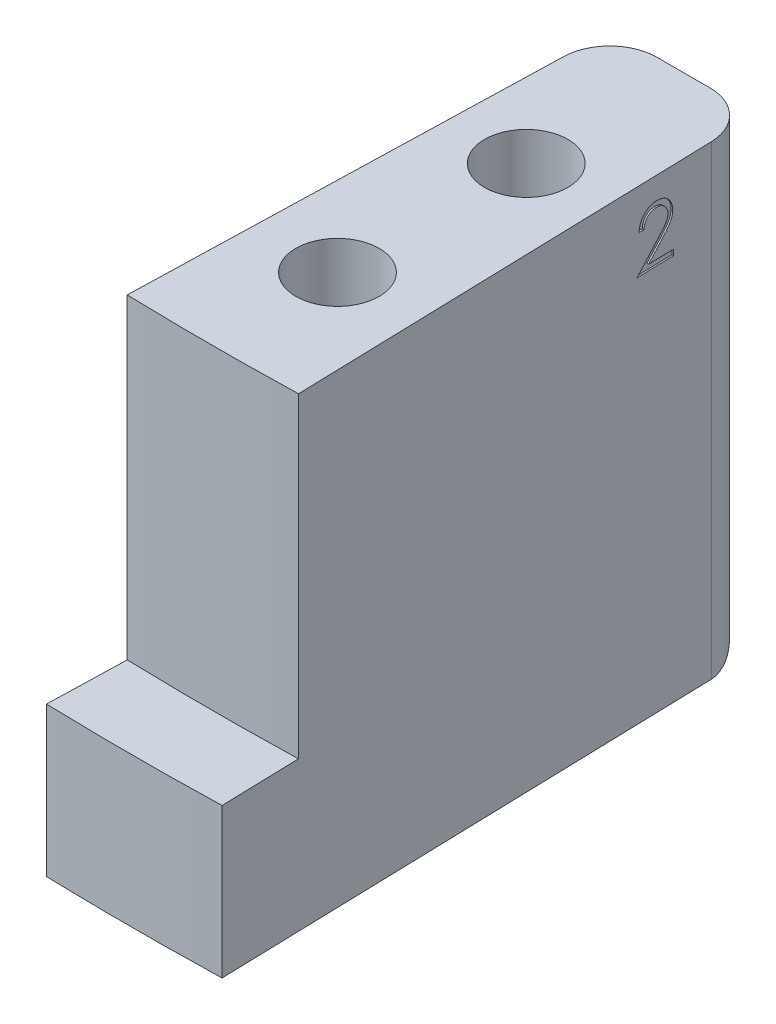
from build123d import *

# Parameters (mm, degrees)
EXTRUDE_590_DEPTH   = 29.6
EXTRUDE_638_DEPTH   = 9.5
FILLET_1_R          = 3
HOLE_WIZARD_M5_1_D  = 5.3
CUT_EXTRUDE_1_DEPTH = 5
CUT_EXTRUDE_2_DEPTH = 0.1


with BuildPart() as part:
    # 草图1 → Extrude 590 (new body)
    with BuildSketch(Plane(origin=(0, 0, 0), x_dir=(1, 0, 0), z_dir=(0, 1, 0))):
        with BuildLine():
            Line((4.608867317, -165), (-4.608867317, -165))
            Line((-4.608867317, -165), (-5.444719551, -194.923972433))
            ThreePointArc((-5.444719551, -194.923972433), (0, -195), (5.444719551, -194.923972433))
            Line((5.444719551, -194.923972433), (4.608867317, -165))
        make_face()
    extrude(amount=EXTRUDE_590_DEPTH)

    # 草图1<3> → Extrude 638 (add)
    with BuildSketch(Plane(origin=(0, 0, 0), x_dir=(1, 0, 0), z_dir=(0, 1, 0))):
        with BuildLine():
            ThreePointArc((5.444719551, -194.923972433), (0, -195), (-5.444719551, -194.923972433))
            Line((-5.444719551, -194.923972433), (-5.584327745, -199.922023008))
            ThreePointArc((-5.584327745, -199.922023008), (0, -200), (5.584327745, -199.922023008))
            Line((5.584327745, -199.922023008), (5.444719551, -194.923972433))
        make_face()
    extrude(amount=EXTRUDE_638_DEPTH)

    # 圆角1
    fillet_1_edges = [part.edges().sort_by_distance(p)[0] for p in [
        (0, 0, 165),
        (-4.608867317, 14.8, 165),
        (4.608867317, 14.8, 165),
    ]]
    fillet(fillet_1_edges, radius=FILLET_1_R)

    # M5 间隙孔1 (through all)
    with Locations(Plane(origin=(0, 29.6, 0), x_dir=(1, 0, 0), z_dir=(0, 1, 0))):
        with Locations((0, -187), (0, -175)):
            Hole(HOLE_WIZARD_M5_1_D / 2)

    # 草图6 → 切除-拉伸1 (cut)
    with BuildSketch(Plane.XZ):
        Polygon((0, 179.792007234), (-4.15, 177.396003617), (-4.15, 172.603996383), (0, 170.207992766), (4.15, 172.603996383), (4.15, 177.396003617), align=None)
        Polygon((0, 191.792007234), (-4.15, 189.396003617), (-4.15, 184.603996383), (0, 182.207992766), (4.15, 184.603996383), (4.15, 189.396003617), align=None)
    extrude(amount=-CUT_EXTRUDE_1_DEPTH, mode=Mode.SUBTRACT)

    # 草图7 → 切除-拉伸2 (cut)
    with BuildSketch(Plane(origin=(0, 0, 0), x_dir=(-0.02792163872356911, 0, -0.9996101150403545), z_dir=(0.9996101150403545, 0, -0.02792163872356911))):
        with BuildLine():
            Line((-172.3983953, 27.023076923), (-172.712497864, 27.023076923))
            add(Edge.make_bspline(
                [(-172.712497864, 27.023076923), (-172.710450711, 27.064747811), (-172.706430157, 27.146588325), (-172.687601868, 27.265912232), (-172.660660991, 27.379967031), (-172.622569537, 27.487836945), (-172.575263259, 27.590475752), (-172.518533231, 27.687475767), (-172.451339381, 27.778466956), (-172.375132647, 27.862605799), (-172.292364008, 27.93979337), (-172.203058068, 28.006448613), (-172.109213041, 28.062766284), (-172.011113642, 28.109847526), (-171.907653079, 28.145187372), (-171.799770221, 28.171409012), (-171.686991084, 28.187185357), (-171.610151062, 28.188881143), (-171.571071582, 28.18974359)],
                knots=[0, 0, 0, 0, 1.10065271, 2.161652631, 3.183658789, 4.190468796, 5.17591951, 6.163126047, 7.15150782, 8.156236427, 9.156009102, 10.134482811, 11.092018607, 12.041330605, 13.001268258, 13.972401359, 14.968799086, 16, 16, 16, 16], degree=3))
            add(Edge.make_bspline(
                [(-171.571071582, 28.18974359), (-171.532693508, 28.188845133), (-171.457281963, 28.187079698), (-171.347219949, 28.171918669), (-171.242442654, 28.148173078), (-171.143154888, 28.114857661), (-171.050148823, 28.070073234), (-170.962725779, 28.016275695), (-170.879844968, 27.954055864), (-170.805238184, 27.88080205), (-170.736730105, 27.802599666), (-170.67762785, 27.719111762), (-170.627014686, 27.632882477), (-170.584827007, 27.543254275), (-170.553770868, 27.449383247), (-170.53019266, 27.352636044), (-170.516865246, 27.252011233), (-170.514819822, 27.183904677), (-170.513779915, 27.149278846)],
                knots=[0, 0, 0, 0, 1.111607364, 2.184268762, 3.212621178, 4.221274766, 5.211760367, 6.196651075, 7.1921475, 8.207485113, 9.220403448, 10.201281604, 11.166441695, 12.114753415, 13.065576456, 14.026450734, 14.996634279, 16, 16, 16, 16], degree=3))
            add(Edge.make_bspline(
                [(-170.513779915, 27.149278846), (-170.515473178, 27.100531012), (-170.51882999, 27.003890798), (-170.547544366, 26.861875935), (-170.592390877, 26.724282516), (-170.646388234, 26.613545214), (-170.700860678, 26.52431172), (-170.749948186, 26.450843015), (-170.807412997, 26.371737547), (-170.874091495, 26.28726021), (-170.948604367, 26.196749304), (-171.03162653, 26.100259509), (-171.123750012, 25.998787739), (-171.188408513, 25.929482138), (-171.221912928, 25.893569712)],
                knots=[0, 0, 0, 0, 1.184426356, 2.348067706, 3.509069118, 4.696110526, 5.333549288, 6.050745305, 6.844228056, 7.710549037, 8.667450064, 9.695053472, 10.805634456, 12, 12, 12, 12], degree=3))
            Line((-171.221912928, 25.893569712), (-172.09761405, 24.958974359))
            Line((-172.09761405, 24.958974359), (-170.46890812, 24.958974359))
            Line((-170.46890812, 24.958974359), (-170.46890812, 24.6))
            Line((-170.46890812, 24.6), (-172.847113249, 24.6))
            Line((-172.847113249, 24.6), (-171.489741454, 26.048517628))
            add(Edge.make_bspline(
                [(-171.489741454, 26.048517628), (-171.456693567, 26.083015935), (-171.39321534, 26.149280121), (-171.303432763, 26.246023081), (-171.222793775, 26.335772622), (-171.150776382, 26.418359171), (-171.088942877, 26.494990738), (-171.034070645, 26.563185442), (-170.990105054, 26.625939892), (-170.942389658, 26.698680506), (-170.896175677, 26.787492823), (-170.856463321, 26.896026513), (-170.832248472, 27.007753765), (-170.829343637, 27.083255802), (-170.827882479, 27.121233974)],
                knots=[0, 0, 0, 0, 1.329631726, 2.553950428, 3.673215718, 4.687767853, 5.603093632, 6.413772471, 7.123043292, 7.734684054, 8.834405432, 9.900288307, 10.943827018, 12, 12, 12, 12], degree=3))
            add(Edge.make_bspline(
                [(-170.827882479, 27.121233974), (-170.828518222, 27.145115373), (-170.829771148, 27.192181023), (-170.840828845, 27.261186782), (-170.857539351, 27.327751596), (-170.881484609, 27.392080215), (-170.913091349, 27.453525867), (-170.951564729, 27.512163347), (-170.995954793, 27.568852313), (-171.047306062, 27.622005611), (-171.103717582, 27.670686816), (-171.163311832, 27.713810902), (-171.226361936, 27.749850012), (-171.292602058, 27.779393509), (-171.361847527, 27.802568891), (-171.434232273, 27.81862747), (-171.509556289, 27.828709954), (-171.560989784, 27.830074126), (-171.587197383, 27.830769231)],
                knots=[0, 0, 0, 0, 0.991446411, 1.95395049, 2.89581595, 3.838931463, 4.798493298, 5.75982156, 6.748411868, 7.785213223, 8.824556874, 9.840280684, 10.836137867, 11.835679398, 12.848801643, 13.863922112, 14.911575587, 16, 16, 16, 16], degree=3))
            add(Edge.make_bspline(
                [(-171.587197383, 27.830769231), (-171.614568216, 27.830054199), (-171.668320012, 27.828649993), (-171.747239045, 27.818827329), (-171.822524823, 27.801881489), (-171.894366726, 27.778704814), (-171.962886312, 27.749246266), (-172.027750356, 27.712554521), (-172.088813245, 27.668771028), (-172.146189768, 27.619130471), (-172.199053747, 27.56386287), (-172.245500623, 27.502252907), (-172.286084637, 27.435425492), (-172.321493871, 27.363560941), (-172.350249561, 27.286007161), (-172.372222711, 27.203039456), (-172.389609558, 27.115018075), (-172.395418079, 27.05423299), (-172.3983953, 27.023076923)],
                knots=[0, 0, 0, 0, 1.031018746, 2.02475058, 2.990194455, 3.934040569, 4.864654155, 5.795059489, 6.735614925, 7.690564532, 8.649604399, 9.611025574, 10.590972636, 11.591080095, 12.624614302, 13.701020113, 14.821632451, 16, 16, 16, 16], degree=3))
        make_face()
    extrude(amount=-CUT_EXTRUDE_2_DEPTH, mode=Mode.SUBTRACT)


solid = part.part
